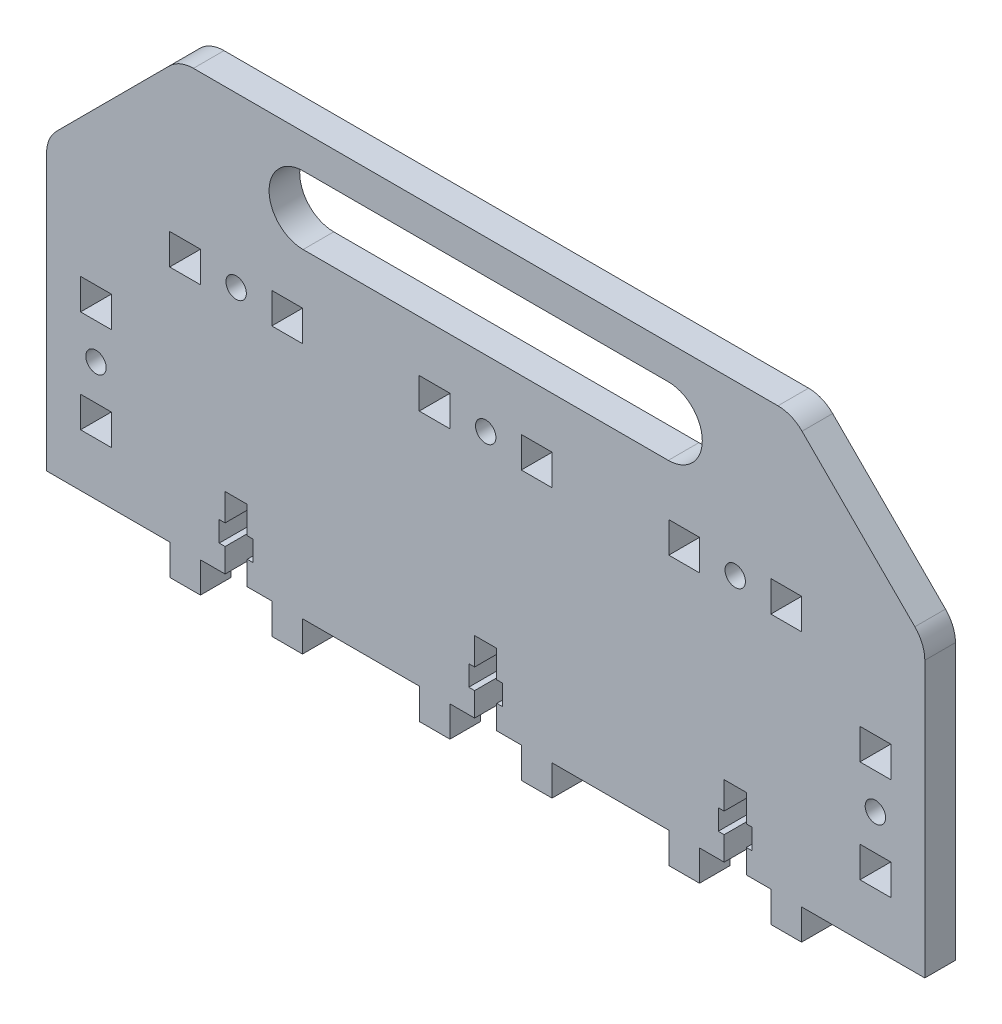
from build123d import *

# Parameters (mm, degrees)
SKETCH1_W           = 9.05
SKETCH1_H           = 9.05
SKETCH1_R           = 3
SKETCH1_W_2         = 9
SKETCH1_H_2         = 9
BOSS_EXTRUDE3_DEPTH = 9


with BuildPart() as part:
    # Sketch1 → Boss-Extrude3 (new body)
    # profile 1 of 11: a face of its own
    with BuildSketch(Plane.XY):
        with BuildLine():
            Line((-129.05, 0), (-110, 0))
            Line((-110, 0), (-92.833333333, 0))
            Line((-92.833333333, 0), (-83.833333333, 0))
            Line((-83.833333333, 0), (-76.583333333, 0))
            Line((-76.583333333, 0), (-76.583333333, 7))
            Line((-76.583333333, 7), (-78.308333333, 7))
            Line((-78.308333333, 7), (-78.308333333, 13))
            Line((-78.308333333, 13), (-76.583333333, 13))
            Line((-76.583333333, 13), (-76.583333333, 21))
            Line((-76.583333333, 21), (-70.083333333, 21))
            Line((-70.083333333, 21), (-70.083333333, 13))
            Line((-70.083333333, 13), (-68.358333333, 13))
            Line((-68.358333333, 13), (-68.358333333, 7))
            Line((-68.358333333, 7), (-70.083333333, 7))
            Line((-70.083333333, 7), (-70.083333333, 0))
            Line((-70.083333333, 0), (-62.833333333, 0))
            Line((-62.833333333, 0), (-53.833333333, 0))
            Line((-53.833333333, 0), (-19.5, 0))
            Line((-19.5, 0), (-10.5, 0))
            Line((-10.5, 0), (-3.25, 0))
            Line((-3.25, 0), (-3.25, 7))
            Line((-3.25, 7), (-4.975, 7))
            Line((-4.975, 7), (-4.975, 13))
            Line((-4.975, 13), (-3.25, 13))
            Line((-3.25, 13), (-3.25, 21))
            Line((-3.25, 21), (3.25, 21))
            Line((3.25, 21), (3.25, 13))
            Line((3.25, 13), (4.975, 13))
            Line((4.975, 13), (4.975, 7))
            Line((4.975, 7), (3.25, 7))
            Line((3.25, 7), (3.25, 0))
            Line((3.25, 0), (10.5, 0))
            Line((10.5, 0), (19.5, 0))
            Line((19.5, 0), (53.833333333, 0))
            Line((53.833333333, 0), (62.833333333, 0))
            Line((62.833333333, 0), (70.083333333, 0))
            Line((70.083333333, 0), (70.083333333, 7))
            Line((70.083333333, 7), (68.358333333, 7))
            Line((68.358333333, 7), (68.358333333, 13))
            Line((68.358333333, 13), (70.083333333, 13))
            Line((70.083333333, 13), (70.083333333, 21))
            Line((70.083333333, 21), (76.583333333, 21))
            Line((76.583333333, 21), (76.583333333, 13))
            Line((76.583333333, 13), (78.308333333, 13))
            Line((78.308333333, 13), (78.308333333, 7))
            Line((78.308333333, 7), (76.583333333, 7))
            Line((76.583333333, 7), (76.583333333, 0))
            Line((76.583333333, 0), (83.833333333, 0))
            Line((83.833333333, 0), (92.833333333, 0))
            Line((92.833333333, 0), (110, 0))
            Line((110, 0), (129.05, 0))
            Line((129.05, 0), (129.05, 80.860739907))
            ThreePointArc((129.05, 80.860739907), (128.289734408, 84.685306297), (126.124538385, 87.928335441))
            Line((126.124538385, 87.928335441), (115.577456423, 98.485778325))
            Line((115.577456423, 98.485778325), (92.967849751, 121.117595535))
            ThreePointArc((92.967849751, 121.117595535), (89.722413393, 123.287855686), (85.893311367, 124.05))
            Line((85.893311367, 124.05), (-85.893311367, 124.05))
            ThreePointArc((-85.893311367, 124.05), (-89.722413393, 123.287855686), (-92.967849751, 121.117595535))
            Line((-92.967849751, 121.117595535), (-126.124538385, 87.928335441))
            ThreePointArc((-126.124538385, 87.928335441), (-128.289734408, 84.685306297), (-129.05, 80.860739907))
            Line((-129.05, 80.860739907), (-129.05, 0))
        make_face()
        with Locations((-114.525, 20)):
            Rectangle(SKETCH1_W, SKETCH1_H, mode=Mode.SUBTRACT)
        with Locations((-114.525, 35)):
            Circle(SKETCH1_R, mode=Mode.SUBTRACT)
        with Locations((-114.525, 50)):
            Rectangle(SKETCH1_W, SKETCH1_H, mode=Mode.SUBTRACT)
        with Locations((114.525, 20)):
            Rectangle(SKETCH1_W, SKETCH1_H, mode=Mode.SUBTRACT)
        with Locations((114.525, 35)):
            Circle(SKETCH1_R, mode=Mode.SUBTRACT)
        with Locations((114.525, 50)):
            Rectangle(SKETCH1_W, SKETCH1_H, mode=Mode.SUBTRACT)
        with Locations((-88.333333333, 74.525)):
            Rectangle(SKETCH1_W, SKETCH1_H, mode=Mode.SUBTRACT)
        with Locations((-73.333333333, 74.525)):
            Circle(SKETCH1_R, mode=Mode.SUBTRACT)
        with Locations((-58.333333333, 74.525)):
            Rectangle(SKETCH1_W, SKETCH1_H, mode=Mode.SUBTRACT)
        with Locations((-15, 74.525)):
            Rectangle(SKETCH1_W, SKETCH1_H, mode=Mode.SUBTRACT)
        with Locations((0, 74.525)):
            Circle(SKETCH1_R, mode=Mode.SUBTRACT)
        with Locations((15, 74.525)):
            Rectangle(SKETCH1_W, SKETCH1_H, mode=Mode.SUBTRACT)
        with Locations((58.333333333, 74.525)):
            Rectangle(SKETCH1_W, SKETCH1_H, mode=Mode.SUBTRACT)
        with Locations((73.333333333, 74.525)):
            Circle(SKETCH1_R, mode=Mode.SUBTRACT)
        with Locations((88.333333333, 74.525)):
            Rectangle(SKETCH1_W, SKETCH1_H, mode=Mode.SUBTRACT)
        with BuildLine():
            ThreePointArc((-53.655258809, 94.05), (-63.655258809, 104.05), (-53.655258809, 114.05))
            Line((-53.655258809, 114.05), (53.655258809, 114.05))
            ThreePointArc((53.655258809, 114.05), (63.655258809, 104.05), (53.655258809, 94.05))
            Line((53.655258809, 94.05), (-53.655258809, 94.05))
        make_face(mode=Mode.SUBTRACT)
    # profile 2 of 11: a face of its own
    with BuildSketch(Plane.XY):
        with Locations((-88.333333333, -4.5)):
            Rectangle(SKETCH1_W_2, SKETCH1_H_2)
    # profile 3 of 11: a face of its own
    with BuildSketch(Plane.XY):
        with Locations((-88.333333333, -4.5)):
            Rectangle(SKETCH1_W_2, SKETCH1_H_2)
    # profile 4 of 11: a face of its own
    with BuildSketch(Plane.XY):
        with Locations((-58.333333333, -4.5)):
            Rectangle(SKETCH1_W_2, SKETCH1_H_2)
    # profile 5 of 11: a face of its own
    with BuildSketch(Plane.XY):
        with Locations((-58.333333333, -4.5)):
            Rectangle(SKETCH1_W_2, SKETCH1_H_2)
    # profile 6 of 11: a face of its own
    with BuildSketch(Plane.XY):
        with Locations((-15, -4.5)):
            Rectangle(SKETCH1_W_2, SKETCH1_H_2)
    # profile 7 of 11: a face of its own
    with BuildSketch(Plane.XY):
        with Locations((15, -4.5)):
            Rectangle(SKETCH1_W_2, SKETCH1_H_2)
    # profile 8 of 11: a face of its own
    with BuildSketch(Plane.XY):
        with Locations((58.333333333, -4.5)):
            Rectangle(SKETCH1_W_2, SKETCH1_H_2)
    # profile 9 of 11: a face of its own
    with BuildSketch(Plane.XY):
        with Locations((58.333333333, -4.5)):
            Rectangle(SKETCH1_W_2, SKETCH1_H_2)
    # profile 10 of 11: a face of its own
    with BuildSketch(Plane.XY):
        with Locations((88.333333333, -4.5)):
            Rectangle(SKETCH1_W_2, SKETCH1_H_2)
    # profile 11 of 11: a face of its own
    with BuildSketch(Plane.XY):
        with Locations((88.333333333, -4.5)):
            Rectangle(SKETCH1_W_2, SKETCH1_H_2)
    extrude(amount=BOSS_EXTRUDE3_DEPTH)


solid = part.part
